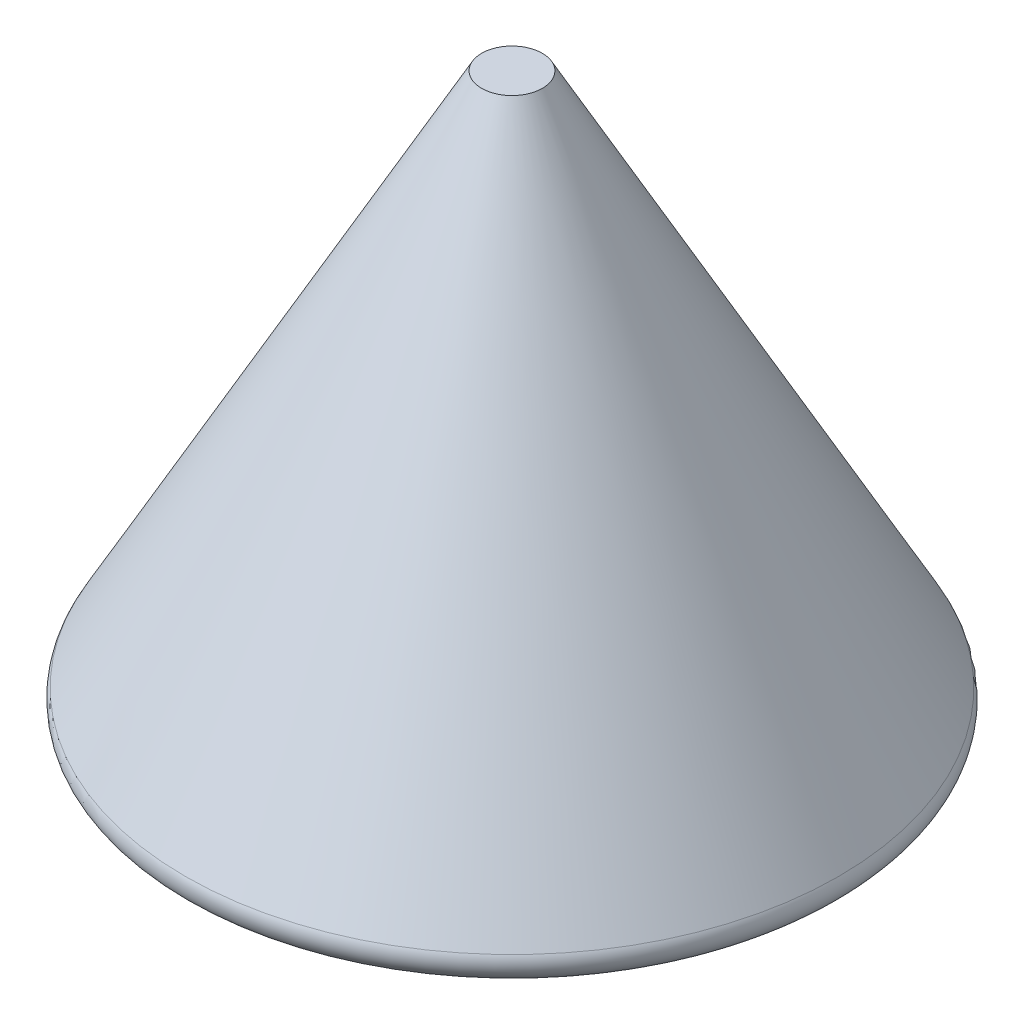
from build123d import *

# Parameters (mm, degrees)
SKETCH1_R           = 36.5
BOSS_EXTRUDE1_DEPTH = 60
BOSS_EXTRUDE1_TAPER = 29
FILLET1_R           = 2


with BuildPart() as part:
    # Sketch1 → Boss-Extrude1 (new body)
    with BuildSketch(Plane(origin=(0, 0, 0), x_dir=(1, 0, 0), z_dir=(0, 1, 0))):
        Circle(SKETCH1_R)
    extrude(amount=BOSS_EXTRUDE1_DEPTH, taper=BOSS_EXTRUDE1_TAPER)

    # Fillet1
    fillet1_edges = [part.edges().sort_by_distance(p)[0] for p in [
        (-36.5, 0, 0),
    ]]
    fillet(fillet1_edges, radius=FILLET1_R)


solid = part.part
